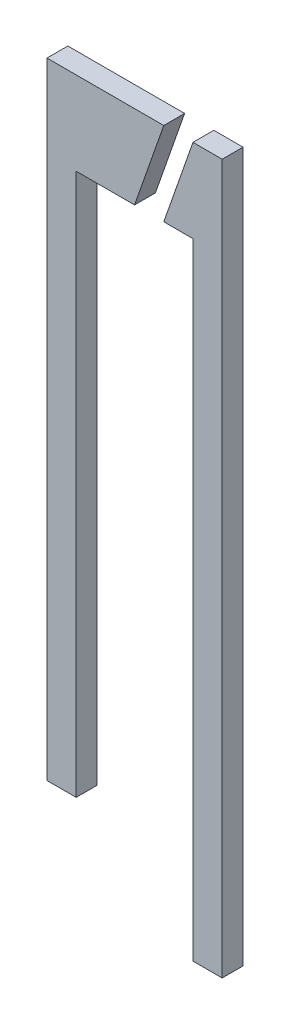
from build123d import *

# Parameters (mm, degrees)
BOSS_EXTRUDE1_DEPTH   = 0.5
BOSS_EXTRUDE1_2_DEPTH = 0.5


with BuildPart() as part:
    # Sketch1 → Boss-Extrude1 (new body)
    with BuildSketch(Plane.XY):
        Polygon((1.4, -15.729262234), (2.1, -15.729262234), (2.1, -32.729262234), (1.4, -32.729262234), (1.4, -17.729262234), (0.7, -17.729262234), align=None)
    extrude(amount=BOSS_EXTRUDE1_DEPTH)


with BuildPart() as body_2:
    # Sketch1 → Boss-Extrude1 2 (new body)
    with BuildSketch(Plane.XY):
        Polygon((0.7, -15.729262234), (0, -17.729262234), (-1.4, -17.729262234), (-1.4, -30.729262234), (-2.1, -30.729262234), (-2.1, -15.729262234), align=None)
    extrude(amount=BOSS_EXTRUDE1_2_DEPTH)


solid = Compound([part.part, body_2.part])
